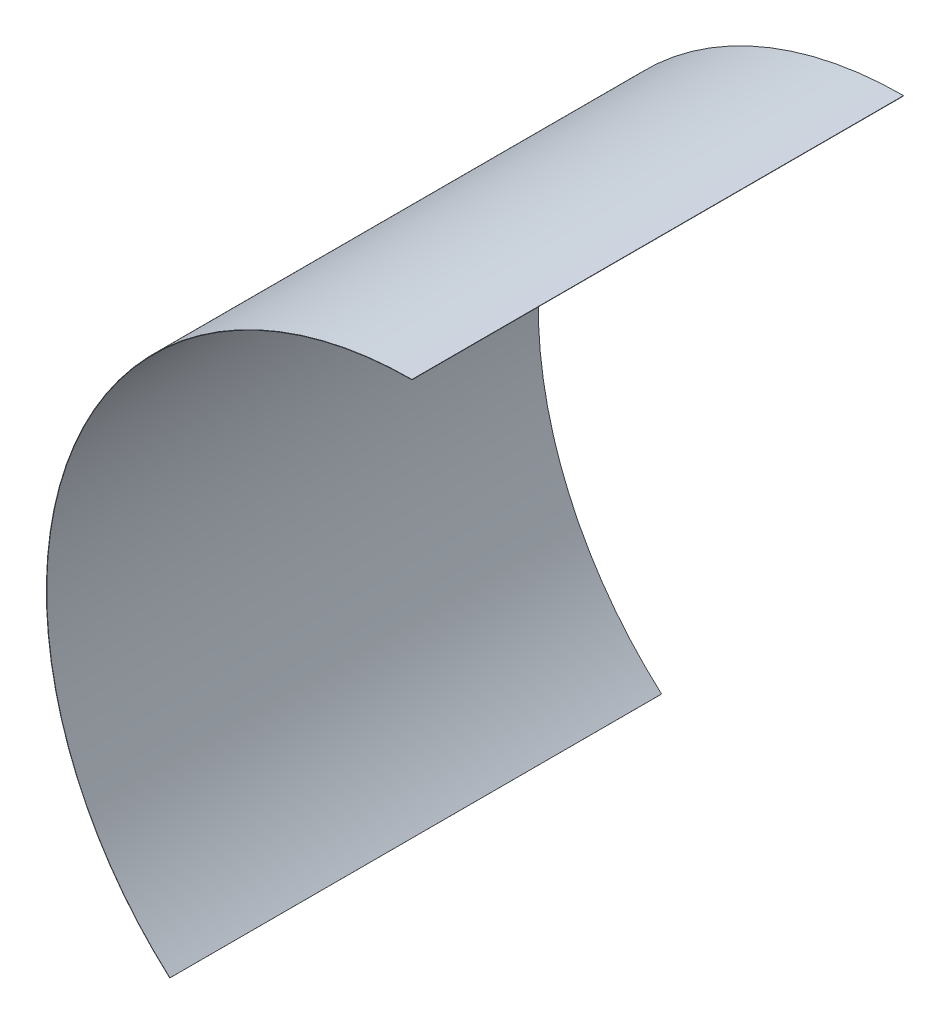
from build123d import *

# Parameters (mm, degrees)
SURFACE_EXTRUDE1_1_DEPTH = 1560
THICKEN1_T2              = 1


with BuildPart() as body_1:
    # Surface-Extrude1: a surface, the sketch's curves swept straight by 1560 mm
    with BuildLine(Plane.XY, mode=Mode.PRIVATE) as surface_extrude1_1_path:
        ThreePointArc((0, 0), (-316.373237578, 1280.050153681), (768.626762422, 2029.313406078))
    surface_extrude1_1 = Shell.extrude(surface_extrude1_1_path.wire(), (0 * SURFACE_EXTRUDE1_1_DEPTH, 0 * SURFACE_EXTRUDE1_1_DEPTH, 1 * SURFACE_EXTRUDE1_1_DEPTH))
    add(Solid.thicken(surface_extrude1_1, -THICKEN1_T2))


solid = body_1.part
